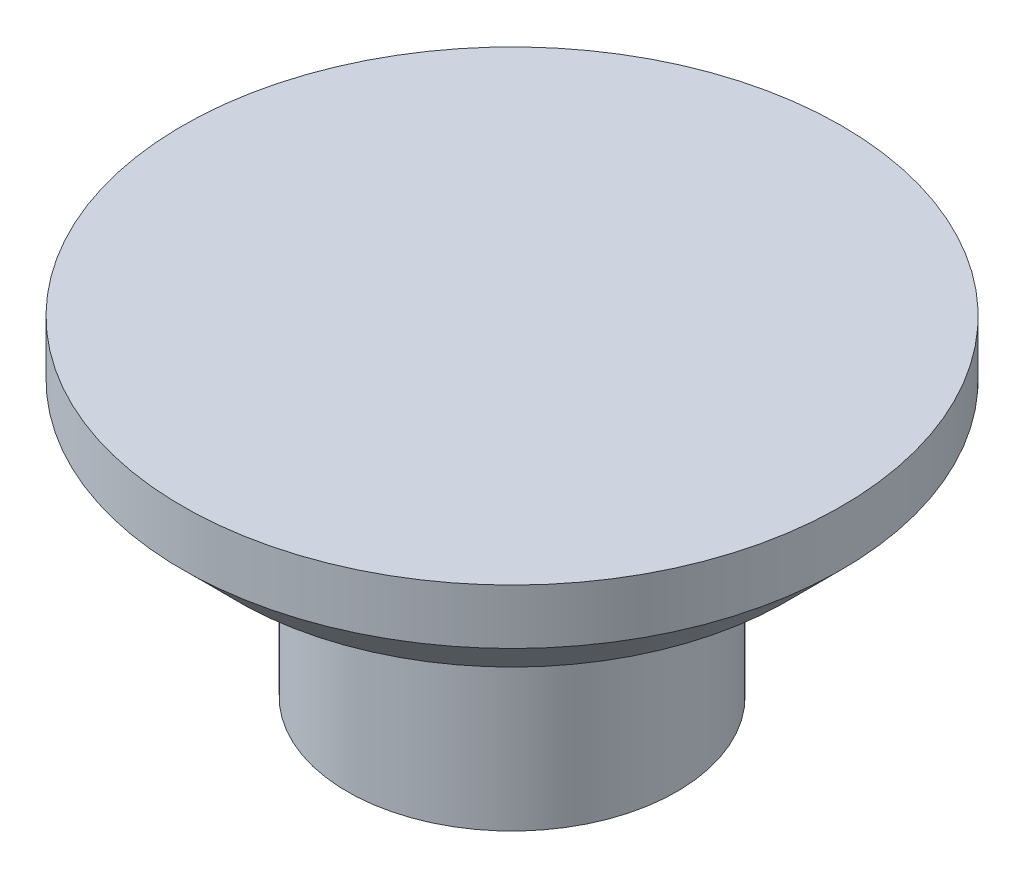
from build123d import *


with BuildPart() as part:
    # Szkic1 → Obrót1 (revolve)
    with BuildSketch(Plane.XY, mode=Mode.PRIVATE) as obr_t1_sk:
        with BuildLine():
            Line((0, 0), (6, 0))
            Line((6, 0), (6, -1))
            Line((6, -1), (5, -2))
            Line((5, -2), (4, -2))
            ThreePointArc((4, -2), (3.292893219, -2.292893219), (3, -3))
            Line((3, -3), (3, -6))
            Line((3, -6), (1.5, -6))
            ThreePointArc((1.5, -6), (1.060660172, -4.939339828), (0, -4.5))
            Line((0, -4.5), (0, 0))
        make_face()
    revolve(obr_t1_sk.sketch.rotate(Axis((0, -4.5, 0), (0, 1, 0)), 90), axis=Axis((0, -4.5, 0), (0, 1, 0)))


solid = part.part
